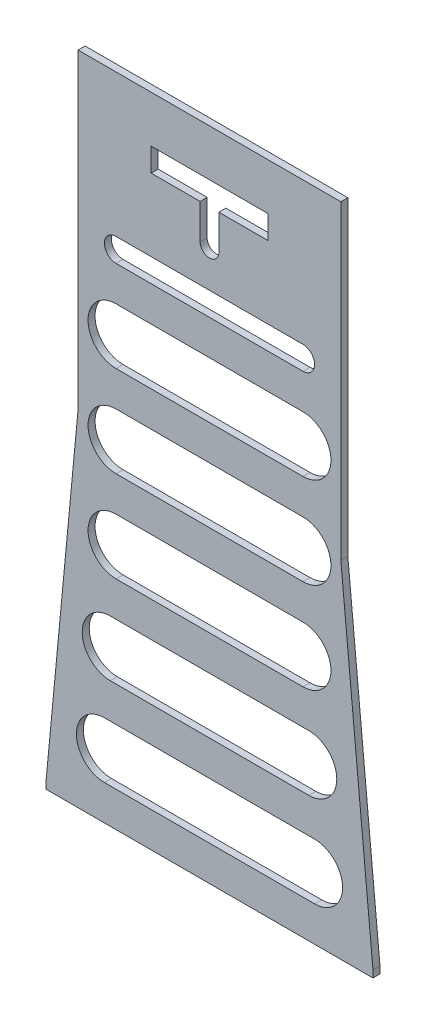
from build123d import *

# Parameters (mm, degrees)
BOSS_EXTRUDE1_DEPTH = 3


with BuildPart() as part:
    # Sketch1 → Boss-Extrude1 (new body)
    with BuildSketch(Plane.XY):
        Polygon((-70, -236), (70, -236), (70, -233), (56.25, -88), (56.25, 45), (-56.25, 45), (-56.25, -88), (-70, -233), align=None)
        with BuildLine():
            Line((40, -16), (-40, -16))
            ThreePointArc((-40, -16), (-45, -21), (-40, -26))
            Line((-40, -26), (40, -26))
            ThreePointArc((40, -26), (45, -21), (40, -16))
        make_face(mode=Mode.SUBTRACT)
        with BuildLine():
            Line((25, 15), (25, 25))
            Line((25, 25), (-25, 25))
            Line((-25, 25), (-25, 15))
            Line((-25, 15), (-4, 15))
            Line((-4, 15), (-4, 0))
            ThreePointArc((-4, 0), (0, -4), (4, 0))
            Line((4, 0), (4, 15))
            Line((4, 15), (25, 15))
        make_face(mode=Mode.SUBTRACT)
        with BuildLine():
            Line((40, -41), (-40, -41))
            ThreePointArc((-40, -41), (-52, -53), (-40, -65))
            Line((-40, -65), (40, -65))
            ThreePointArc((40, -65), (52, -53), (40, -41))
        make_face(mode=Mode.SUBTRACT)
        with BuildLine():
            Line((40, -80), (-40, -80))
            ThreePointArc((-40, -80), (-52, -92), (-40, -104))
            Line((-40, -104), (40, -104))
            ThreePointArc((40, -104), (52, -92), (40, -80))
        make_face(mode=Mode.SUBTRACT)
        with BuildLine():
            Line((40, -119), (-40, -119))
            ThreePointArc((-40, -119), (-52, -131), (-40, -143))
            Line((-40, -143), (40, -143))
            ThreePointArc((40, -143), (52, -131), (40, -119))
        make_face(mode=Mode.SUBTRACT)
        with BuildLine():
            Line((42.5, -158), (-42.5, -158))
            ThreePointArc((-42.5, -158), (-54.5, -170), (-42.5, -182))
            Line((-42.5, -182), (42.5, -182))
            ThreePointArc((42.5, -182), (54.5, -170), (42.5, -158))
        make_face(mode=Mode.SUBTRACT)
        with BuildLine():
            Line((45, -197), (-45, -197))
            ThreePointArc((-45, -197), (-57, -209), (-45, -221))
            Line((-45, -221), (45, -221))
            ThreePointArc((45, -221), (57, -209), (45, -197))
        make_face(mode=Mode.SUBTRACT)
    extrude(amount=BOSS_EXTRUDE1_DEPTH)


solid = part.part
